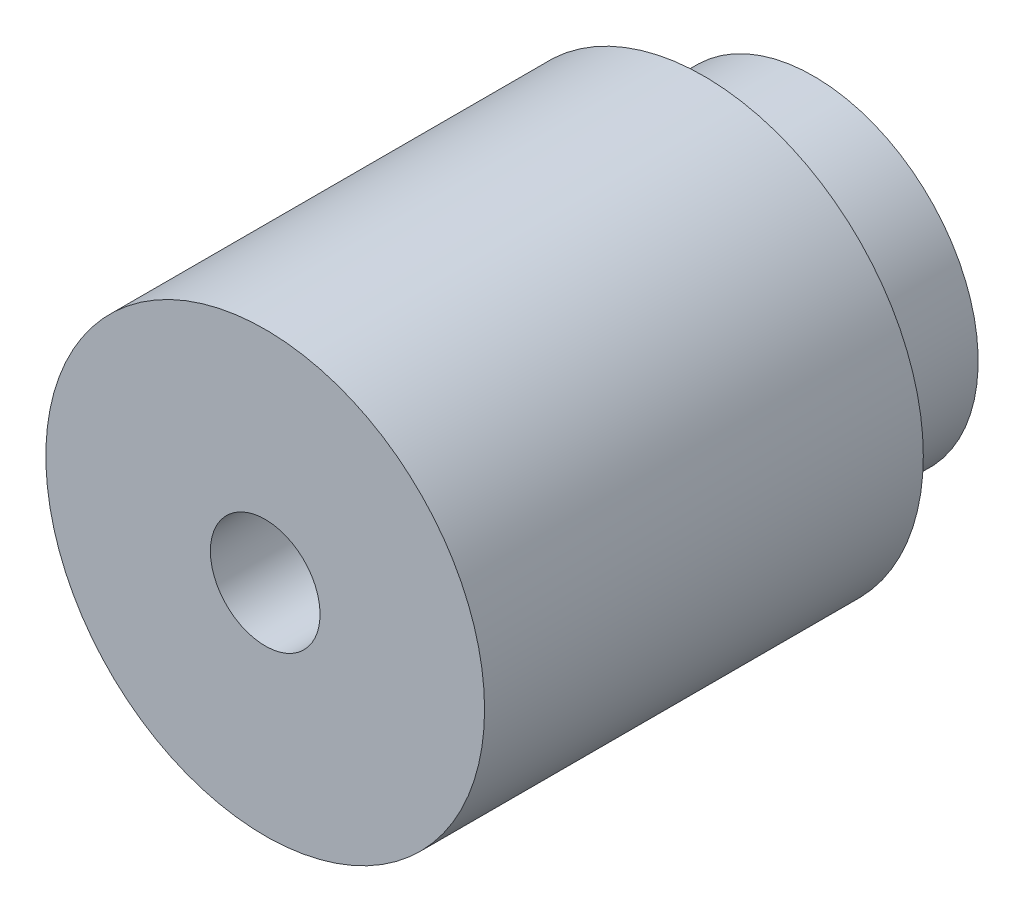
from build123d import *

# Parameters (mm, degrees)
SKETCH_1_R          = 20
EXTRUDE_1_DEPTH     = 40
SKETCH_2_R          = 15
EXTRUDE_2_DEPTH     = 10
SKETCH_3_R          = 5
CUT_EXTRUDE_1_DEPTH = 50


with BuildPart() as part:
    # 草图1 → 凸台-拉伸1 (new body)
    with BuildSketch(Plane.XY):
        Circle(SKETCH_1_R)
    extrude(amount=EXTRUDE_1_DEPTH)


with BuildPart() as body_2:
    # 草图2 → 凸台-拉伸2 (new body)
    with BuildSketch(Plane(origin=(0, 0, 0), x_dir=(-1, 0, 0), z_dir=(0, 0, -1))):
        Circle(SKETCH_2_R)
    extrude(amount=EXTRUDE_2_DEPTH)


with BuildPart() as cut_extrude_1_tool:
    # 草图3 → 切除-拉伸1 (new body)
    with BuildSketch(Plane(origin=(0, 0, -10), x_dir=(-1, 0, 0), z_dir=(0, 0, -1))):
        Circle(SKETCH_3_R)
    extrude(amount=-CUT_EXTRUDE_1_DEPTH)


with BuildPart() as part_1:
    add(part.part)

    # 切除-拉伸1: cut by cut_extrude_1_tool
    add(cut_extrude_1_tool.part, mode=Mode.SUBTRACT)


with BuildPart() as body_2_1:
    add(body_2.part)

    # 切除-拉伸1: cut by cut_extrude_1_tool
    add(cut_extrude_1_tool.part, mode=Mode.SUBTRACT)


solid = Compound([part_1.part, body_2_1.part])
